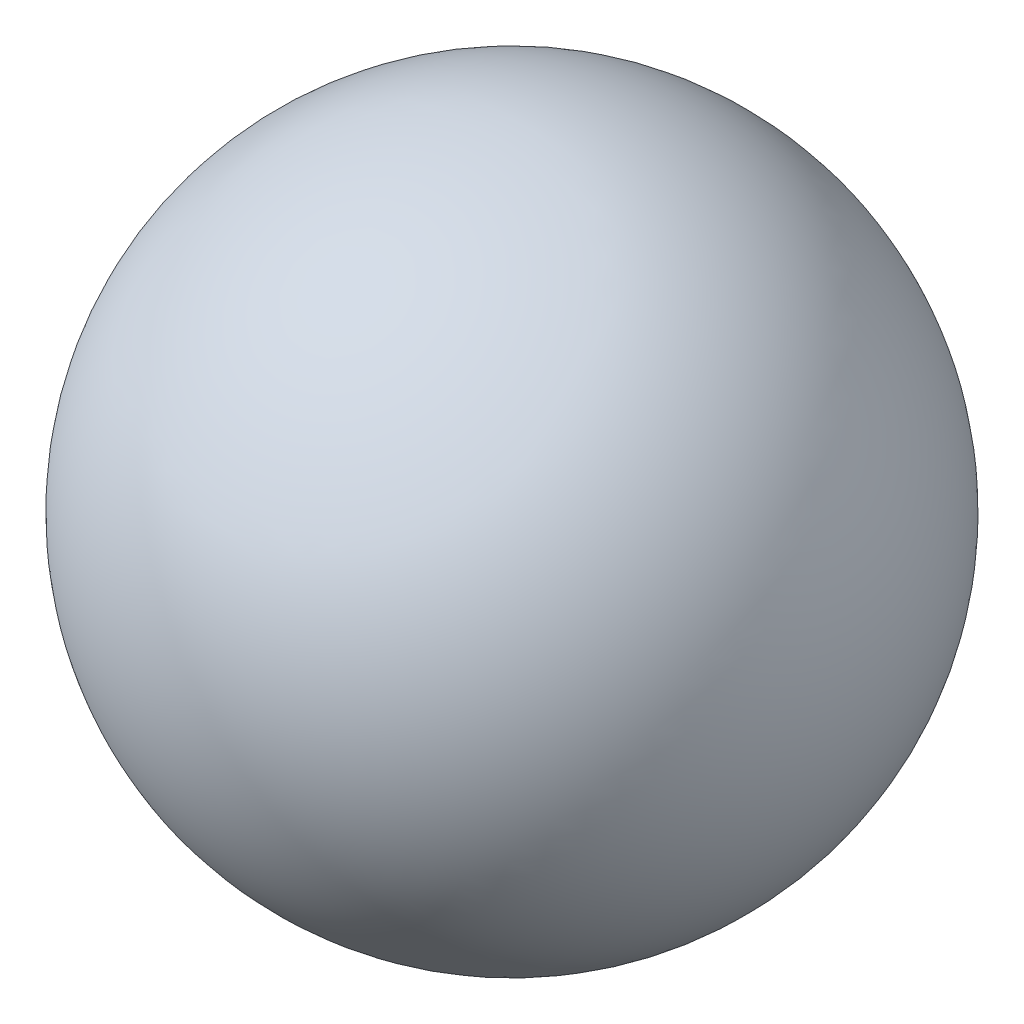
from build123d import *


with BuildPart() as part:
    # 草图1 → 旋转1 (revolve)
    with BuildSketch(Plane(origin=(0, 0, 0), x_dir=(1, 0, 0), z_dir=(0, 1, 0))):
        with BuildLine():
            Line((0, 22.753424658), (0, -21.246575342))
            ThreePointArc((0, -21.246575342), (22, 0.753424658), (0, 22.753424658))
        make_face()
    revolve(axis=Axis((0, 0, -22.753424658), (0, 0, 1)))


solid = part.part
